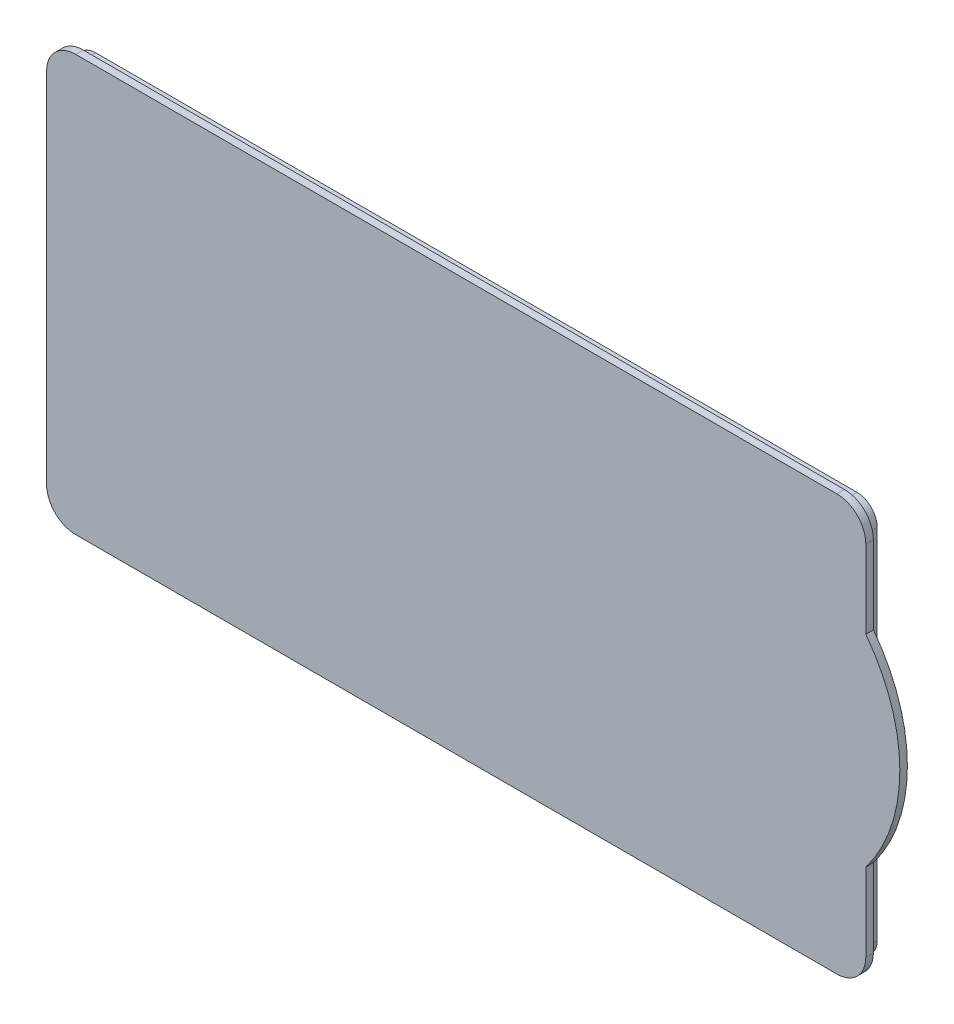
from build123d import *

# Parameters (mm, degrees)
BOSS_EXTRUDE2_DEPTH = 3
EXTRUDE_1_DEPTH     = 5
EXTRUDE_2_DEPTH     = 3


with BuildPart() as part:
    # Sketch3 → Boss-Extrude2 (new body)
    with BuildSketch(Plane.XY):
        with BuildLine():
            Line((-151, 81), (151, 81))
            ThreePointArc((151, 81), (158.071067812, 78.071067812), (161, 71))
            Line((161, 71), (161, -71))
            ThreePointArc((161, -71), (158.071067812, -78.071067812), (151, -81))
            Line((151, -81), (-151, -81))
            ThreePointArc((-151, -81), (-158.071067812, -78.071067812), (-161, -71))
            Line((-161, -71), (-161, 71))
            ThreePointArc((-161, 71), (-158.071067812, 78.071067812), (-151, 81))
        make_face()
    extrude(amount=-BOSS_EXTRUDE2_DEPTH)

    # Эскиз1 → Бобышка-Вытянуть1 (add)
    with BuildSketch(Plane(origin=(0, 0, -3), x_dir=(-1, 0, 0), z_dir=(0, 0, -1))):
        with BuildLine():
            Line((-151, -79), (151, -79))
            ThreePointArc((151, -79), (156.656854249, -76.656854249), (159, -71))
            Line((159, -71), (159, 71))
            ThreePointArc((159, 71), (156.656854249, 76.656854249), (151, 79))
            Line((151, 79), (-151, 79))
            ThreePointArc((-151, 79), (-156.656854249, 76.656854249), (-159, 71))
            Line((-159, 71), (-159, -71))
            ThreePointArc((-159, -71), (-156.656854249, -76.656854249), (-151, -79))
        make_face()
    extrude(amount=EXTRUDE_1_DEPTH)

    # Эскиз2 → Бобышка-Вытянуть2 (add)
    with BuildSketch(Plane.XY):
        with BuildLine():
            Line((162.5, 40), (162.5, 71))
            ThreePointArc((162.5, 71), (159.131727984, 79.131727984), (151, 82.5))
            Line((151, 82.5), (-151, 82.5))
            ThreePointArc((-151, 82.5), (-159.131727984, 79.131727984), (-162.5, 71))
            Line((-162.5, 71), (-162.5, -71))
            ThreePointArc((-162.5, -71), (-159.131727984, -79.131727984), (-151, -82.5))
            Line((-151, -82.5), (151, -82.5))
            ThreePointArc((151, -82.5), (159.131727984, -79.131727984), (162.5, -71))
            Line((162.5, -71), (162.5, -40))
            ThreePointArc((162.5, -40), (176, 0), (162.5, 40))
        make_face()
    extrude(amount=-EXTRUDE_2_DEPTH)


solid = part.part
